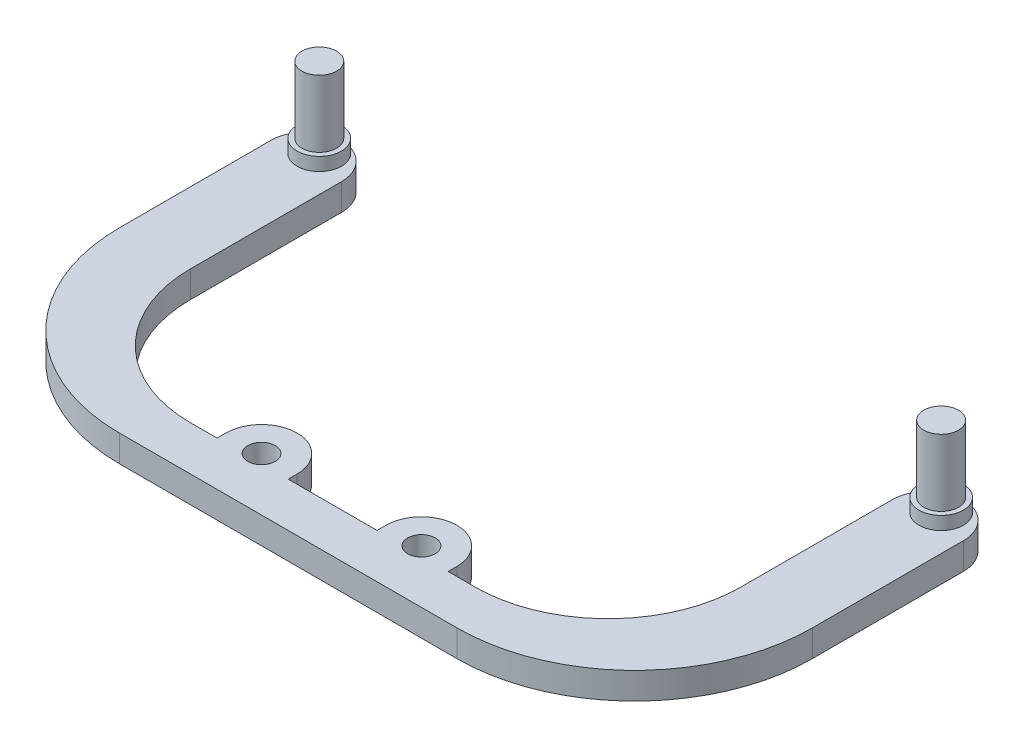
from build123d import *

# Parameters (mm, degrees)
EXTRUDE_1_DEPTH     = 3
SKETCH_2_R          = 1.55
CUT_EXTRUDE_1_DEPTH = 3
SKETCH_3_R          = 1.95
EXTRUDE_2_DEPTH     = 9
FILLET_4_RADIUS     = 4
FILLET_4_LENGTH     = 3
FILLET_5_RADIUS     = 4
FILLET_5_LENGTH     = 3
SKETCH_4_R          = 2.5
EXTRUDE_3_DEPTH     = 1.48
FILLET_6_R          = 15
FILLET_7_R          = 20
CUT_EXTRUDE_2_DEPTH = 55.5068803


with BuildPart() as part:
    # 草图1 → 凸台-拉伸1 (new body)
    with BuildSketch(Plane(origin=(0, 0, 0), x_dir=(1, 0, 0), z_dir=(0, 1, 0))):
        Polygon((-39, 37), (-31, 37), (-31, 0), (-13, 0), (-13, 5), (-5, 5), (-5, 0), (0, 0), (0, -5), (-39, -5), align=None)
    extrude_1 = extrude(amount=EXTRUDE_1_DEPTH)

    # 草图2 → 切除-拉伸1 (cut)
    with BuildSketch(Plane(origin=(0, 3, 0), x_dir=(1, 0, 0), z_dir=(0, 1, 0))):
        with Locations(Location((-9, 1, 0), (0, 0, 270))):
            Circle(SKETCH_2_R)
    cut_extrude_1 = extrude(amount=-CUT_EXTRUDE_1_DEPTH, mode=Mode.SUBTRACT)

    # 草图3 → 凸台-拉伸2 (add)
    with BuildSketch(Plane(origin=(0, 3, 0), x_dir=(1, 0, 0), z_dir=(0, 1, 0))):
        with Locations(Location((-35, 33.5, 0), (0, 0, 90))):
            Circle(SKETCH_3_R)
    extrude_2 = extrude(amount=EXTRUDE_2_DEPTH)

    # 镜向1: 凸台-拉伸1, 切除-拉伸1, 凸台-拉伸2 across plane
    add(extrude_1.mirror(Plane(origin=(0, 3, 0), x_dir=(0, 0, 1), z_dir=(-1, 0, 0))))
    add(cut_extrude_1.mirror(Plane(origin=(0, 3, 0), x_dir=(0, 0, 1), z_dir=(-1, 0, 0))), mode=Mode.SUBTRACT)
    add(extrude_2.mirror(Plane(origin=(0, 3, 0), x_dir=(0, 0, 1), z_dir=(-1, 0, 0))))

    # 圆角4: full round fillet: the end face becomes a half cylinder, R = half its width
    fillet_4_face = Plane((-9, 1.5, -5), x_dir=(0, 1, 0), z_dir=(0, 0, -1))  # on the end face: x along it, z out of the body
    fillet_4_slab = fillet_4_face.offset(-FILLET_4_RADIUS / 2) * Box(FILLET_4_LENGTH, 2 * FILLET_4_RADIUS, FILLET_4_RADIUS, mode=Mode.PRIVATE)  # the body's end, R deep
    fillet_4_round = Plane((-9, 1.5, -1), x_dir=(0, 0, -1), z_dir=(0, 1, 0)) * Cylinder(FILLET_4_RADIUS, FILLET_4_LENGTH, mode=Mode.PRIVATE)  # its axis R under the face
    add(fillet_4_slab - fillet_4_round, mode=Mode.SUBTRACT)

    # 圆角5: full round fillet: the end face becomes a half cylinder, R = half its width
    fillet_5_face = Plane((9, 1.5, -5), x_dir=(0, -1, 0), z_dir=(0, 0, -1))  # on the end face: x along it, z out of the body
    fillet_5_slab = fillet_5_face.offset(-FILLET_5_RADIUS / 2) * Box(FILLET_5_LENGTH, 2 * FILLET_5_RADIUS, FILLET_5_RADIUS, mode=Mode.PRIVATE)  # the body's end, R deep
    fillet_5_round = Plane((9, 1.5, -1), x_dir=(0, 0, -1), z_dir=(0, -1, 0)) * Cylinder(FILLET_5_RADIUS, FILLET_5_LENGTH, mode=Mode.PRIVATE)  # its axis R under the face
    add(fillet_5_slab - fillet_5_round, mode=Mode.SUBTRACT)

    # 草图4 → 凸台-拉伸3 (add)
    with BuildSketch(Plane(origin=(0, 3, 0), x_dir=(1, 0, 0), z_dir=(0, 1, 0))):
        with Locations(Location((-35, 33.5, 0), (0, 0, 90))):
            Circle(SKETCH_4_R)
    extrude_3 = extrude(amount=EXTRUDE_3_DEPTH)

    # 镜向2: 凸台-拉伸3 across plane
    add(extrude_3.mirror(Plane(origin=(0, 0, 0), x_dir=(0, 0, 1), z_dir=(1, 0, 0))))

    # 圆角6
    fillet_6_edges = [part.edges().sort_by_distance(p)[0] for p in [
        (-31, 1.5, 0),
        (31, 1.5, 0),
    ]]
    fillet(fillet_6_edges, radius=FILLET_6_R)

    # 圆角7
    fillet_7_edges = [part.edges().sort_by_distance(p)[0] for p in [
        (-39, 1.5, 5),
        (39, 1.5, 5),
    ]]
    fillet(fillet_7_edges, radius=FILLET_7_R)

    # 草图5 → 切除-拉伸2 (cut, through all)
    with BuildSketch(Plane(origin=(0, 3, 0), x_dir=(1, 0, 0), z_dir=(0, 1, 0))):
        with BuildLine():
            Line((-39, 32), (-39, 37))
            Line((-39, 37), (-31, 37))
            Line((-31, 37), (-31, 32))
            ThreePointArc((-31, 32), (-35, 36), (-39, 32))
        make_face()
    cut_extrude_2 = extrude(amount=-CUT_EXTRUDE_2_DEPTH, mode=Mode.SUBTRACT)

    # 镜向3: 切除-拉伸2 across plane
    add(cut_extrude_2.mirror(Plane(origin=(0, 0, 0), x_dir=(0, 0, 1), z_dir=(1, 0, 0))), mode=Mode.SUBTRACT)


solid = part.part
